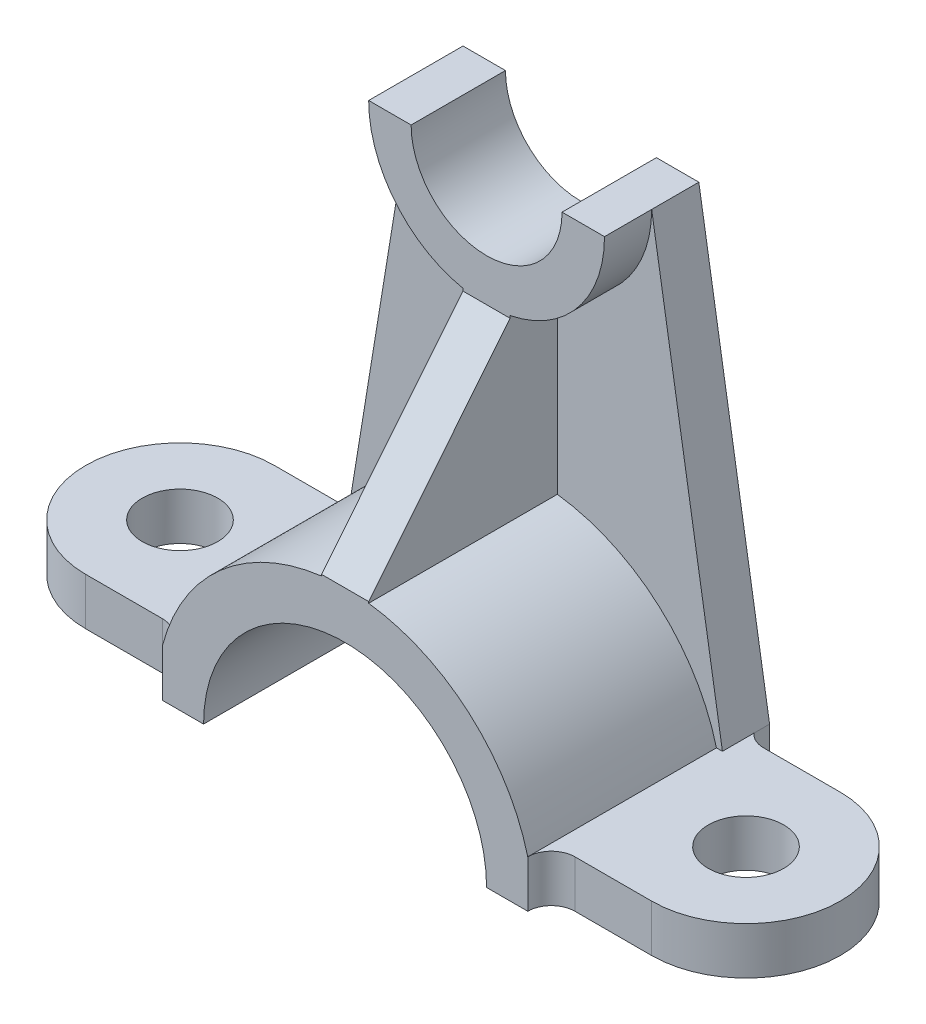
from build123d import *

# Parameters (mm, degrees)
BOSS_EXTRUDE1_DEPTH      = 40
BOSS_EXTRUDE2_REACH      = 151.282
BOSS_EXTRUDE2_END_RADIUS = 39.99999999999999
BOSS_EXTRUDE2_START      = 80
SKETCH2_W                = 50.00000000000001
SKETCH2_H                = 10
CUT_EXTRUDE6_START       = -10
CUT_EXTRUDE6_DEPTH       = 10
BOSS_EXTRUDE4_DEPTH      = 102
CUT_EXTRUDE7_REACH       = 140.939
BOSS_EXTRUDE5_DEPTH      = 10
CUT_EXTRUDE8_START       = -10
CUT_EXTRUDE8_DEPTH       = 10
CUT_EXTRUDE9_REACH       = 133.773
SKETCH9_R                = 8.000000000000012
BOSS_EXTRUDE6_DEPTH      = 5


with BuildPart() as part:
    # Sketch1 → Boss-Extrude1 (new body)
    with BuildSketch(Plane.XY):
        with BuildLine():
            Line((-39.999999999999986, 0), (-30, 0))
            ThreePointArc((-30, 0), (1.84e-15, 30), (30, 0))
            Line((30, 0), (39.99999999999999, 0))
            ThreePointArc((39.99999999999999, 0), (2.45e-15, 39.99999999999999), (-39.999999999999986, 0))
        make_face()
    extrude(amount=-BOSS_EXTRUDE1_DEPTH)

    # Boss-Extrude2: up to this cylinder (the profile starts outside it)
    boss_extrude2_end = Plane(origin=(0, 0, -25), z_dir=(0, 0, 1)) * Cylinder(BOSS_EXTRUDE2_END_RADIUS, 383.564, mode=Mode.PRIVATE)
    # Sketch2 → Boss-Extrude2 (add, up to the surface)
    with BuildSketch(Plane(origin=(0, 0, 0), x_dir=(0, 0, -1), z_dir=(1, 0, 0)).offset(BOSS_EXTRUDE2_START), mode=Mode.PRIVATE) as boss_extrude2_sk1:
        with Locations((25.000000000000004, 5)):
            Rectangle(SKETCH2_W, SKETCH2_H)
    boss_extrude2_tool1 = extrude(boss_extrude2_sk1.sketch, amount=-BOSS_EXTRUDE2_REACH, mode=Mode.PRIVATE) - boss_extrude2_end
    boss_extrude2 = boss_extrude2_tool1.solids().sort_by_distance((80, 5, -25))[0]
    add(boss_extrude2)

    # Sketch3 → Cut-Extrude6 (cut)
    with BuildSketch(Plane(origin=(0, 10, 0), x_dir=(1, 0, 0), z_dir=(0, 1, 0)).offset(CUT_EXTRUDE6_START)):
        with BuildLine():
            ThreePointArc((43.72983346207417, 5.000000000000001), (40.194299556141424, 3.5355339059327426), (38.72983346207416, 0))
            Line((38.72983346207416, 0), (80, 0))
            Line((80, 0), (80, 25.000000000000007))
            ThreePointArc((80, 25.000000000000007), (74.14213562373095, 10.857864376269053), (60, 5))
            Line((60, 5.000000000000001), (43.72983346207417, 5))
        make_face()
        with BuildLine():
            Line((80, 50), (38.72983346207416, 50))
            ThreePointArc((38.72983346207416, 50), (40.194299556141424, 46.464466094067255), (43.72983346207417, 45))
            Line((43.72983346207417, 45), (60, 45))
            ThreePointArc((60, 45), (74.14213562373095, 39.14213562373095), (80, 25.000000000000007))
            Line((80, 25.000000000000007), (80, 50))
        make_face()
    cut_extrude6 = extrude(amount=CUT_EXTRUDE6_DEPTH, mode=Mode.SUBTRACT)

    # Mirror1: Boss-Extrude2, Cut-Extrude6 across plane
    add(boss_extrude2.mirror(Plane(origin=(0, 0, 0), x_dir=(0, 0, 1), z_dir=(1, 0, 0))))
    add(cut_extrude6.mirror(Plane(origin=(0, 0, 0), x_dir=(0, 0, 1), z_dir=(1, 0, 0))), mode=Mode.SUBTRACT)

    # Sketch4 → Boss-Extrude4 (add)
    with BuildSketch(Plane(origin=(0, 0, 0), x_dir=(1, 0, 0), z_dir=(0, 1, 0))):
        Polygon((-39.99999999999999, 40), (39.99999999999999, 40), (39.99999999999999, 50.00000000000003), (-39.99999999999999, 50), align=None)
    extrude(amount=BOSS_EXTRUDE4_DEPTH)

    # Sketch6 → Cut-Extrude7 (cut, up to next)
    with BuildSketch(Plane(origin=(-1.735e-14, 0, -50.000000000000014), x_dir=(-1, 0, 3.5e-16), z_dir=(-3.5e-16, 0, -1)), mode=Mode.PRIVATE) as cut_extrude7_sk1:
        with BuildLine():
            Line((-30, 0), (30, 0))
            ThreePointArc((30, 0), (1.84e-15, 30), (-30, 0))
        make_face()
    cut_extrude7_tool1 = extrude(cut_extrude7_sk1.sketch, amount=-CUT_EXTRUDE7_REACH, mode=Mode.PRIVATE) & part.part
    add(cut_extrude7_tool1.solids().sort_by_distance((0, 12.732395, -50))[0], mode=Mode.SUBTRACT)

    # Sketch7 → Boss-Extrude5 (add)
    with BuildSketch(Plane.XY.offset(-40)):
        with BuildLine():
            Line((-25, 102), (-16, 102))
            ThreePointArc((-16, 102), (-2.94e-15, 86), (16, 102))
            Line((16, 102), (25, 102))
            ThreePointArc((25, 102), (-4.59e-15, 77), (-25, 102))
        make_face()
    extrude(amount=BOSS_EXTRUDE5_DEPTH)

    # Sketch8 → Cut-Extrude8 (cut)
    with BuildSketch(Plane.XY.offset(-40).offset(CUT_EXTRUDE8_START)):
        with BuildLine():
            Line((16, 102), (-16, 101.99999999999989))
            ThreePointArc((-16, 101.99999999999989), (5.782e-14, 85.99999999999994), (16, 102))
        make_face()
        Polygon((-25, 102), (-39.99999999999999, 102), (-39.99999999999999, 10), align=None)
        Polygon((25.000000000000004, 102), (39.99999999999999, 102), (39.99999999999999, 9.999999999999998), align=None)
    extrude(amount=CUT_EXTRUDE8_DEPTH, mode=Mode.SUBTRACT)

    # Sketch9 → Cut-Extrude9 (cut, up to next)
    with BuildSketch(Plane(origin=(0, 10, 0), x_dir=(1, 0, 0), z_dir=(0, 1, 0)), mode=Mode.PRIVATE) as cut_extrude9_sk1:
        with Locations(Location((60, 25, 0), (0, 0, 270))):
            Circle(SKETCH9_R)
    cut_extrude9_tool1 = extrude(cut_extrude9_sk1.sketch, amount=-CUT_EXTRUDE9_REACH, mode=Mode.PRIVATE) & part.part
    cut_extrude9 = cut_extrude9_tool1.solids().sort_by_distance((60, 10, -25))[0]
    add(cut_extrude9, mode=Mode.SUBTRACT)

    # Mirror2: Cut-Extrude9 across plane
    add(cut_extrude9.mirror(Plane(origin=(0, 0, 0), x_dir=(0, 0, 1), z_dir=(1, 0, 0))), mode=Mode.SUBTRACT)

    # Sketch11 → Boss-Extrude6 (add, symmetric)
    with BuildSketch(Plane(origin=(0, 0, 0), x_dir=(0, 0, -1), z_dir=(1, 0, 0))):
        Polygon((0, 30), (0, 39.99999999999999), (30, 76.99999999999999), (30, 86), (40, 86), (40, 30), align=None)
    extrude(amount=BOSS_EXTRUDE6_DEPTH, both=True)


solid = part.part
